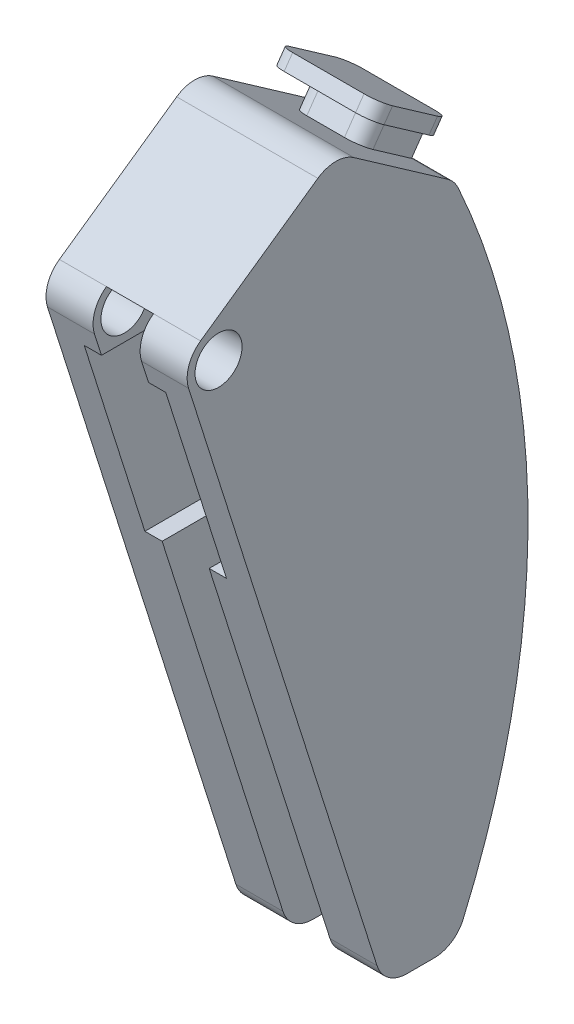
from build123d import *

# Parameters (mm, degrees)
BOSS_EXTRUDE1_DEPTH = 5.715
SKETCH4_W           = 3.81
SKETCH4_H           = 55.271796861
CUT_EXTRUDE3_DEPTH  = 72.793515752
SKETCH6_R           = 1.905
CUT_EXTRUDE5_DEPTH  = 73.472702303
SKETCH5_W           = 6.604
SKETCH5_H           = 15.494
CUT_EXTRUDE4_DEPTH  = 52.07
BOSS_EXTRUDE2_DEPTH = 1.905
BOSS_EXTRUDE3_DEPTH = 1.2


with BuildPart() as part:
    # Sketch1 → Boss-Extrude1 (new, symmetric)
    with BuildSketch(Plane(origin=(0, 0, 0), x_dir=(0, 0, -1), z_dir=(1, 0, 0))):
        with BuildLine():
            Line((56.986930037, 27.2309067), (49.395231729, 32.546671083))
            ThreePointArc((49.395231729, 32.546671083), (47.938347581, 33.00602489), (46.481463433, 32.546671083))
            Line((46.481463433, 32.546671083), (36.982659893, 25.89553724))
            ThreePointArc((36.982659893, 25.89553724), (36.033680051, 24.629396088), (36.018345244, 23.047169493))
            Line((36.018345244, 23.047169493), (51.273584689, -25.063981175))
            ThreePointArc((51.273584689, -25.063981175), (52.194518967, -26.3458465), (53.694783485, -26.836259621))
            Line((53.694783485, -26.836259621), (55.908973953, -26.836259621))
            ThreePointArc((55.908973953, -26.836259621), (57.301856909, -26.420283413), (58.238514534, -25.308603771))
            ThreePointArc((58.238514534, -25.308603771), (63.498135482, 0.4866111), (57.843797801, 26.198188029))
            ThreePointArc((57.843797801, 26.198188029), (57.484796778, 26.772157225), (56.986930037, 27.2309067))
        make_face()
    extrude(amount=BOSS_EXTRUDE1_DEPTH, both=True)

    # Sketch4 → Cut-Extrude3 (cut, through all)
    with BuildSketch(Plane.XY):
        with Locations((0, -1.74036119)):
            Rectangle(SKETCH4_W, SKETCH4_H)
    extrude(amount=-CUT_EXTRUDE3_DEPTH, mode=Mode.SUBTRACT)

    # Sketch6 → Cut-Extrude5 (cut, through all)
    with BuildSketch(Plane(origin=(5.715, 0, 0), x_dir=(0, 0, -1), z_dir=(1, 0, 0))):
        with Locations((38.439544041, 23.814891048)):
            Circle(SKETCH6_R)
    extrude(amount=-CUT_EXTRUDE5_DEPTH, mode=Mode.SUBTRACT)

    # Sketch5 → Cut-Extrude4 (cut)
    with BuildSketch(Plane.XY):
        with Locations((0, 13.527891048)):
            Rectangle(SKETCH5_W, SKETCH5_H)
    extrude(amount=-CUT_EXTRUDE4_DEPTH, mode=Mode.SUBTRACT)

    # Sketch7 → Boss-Extrude2 (add)
    with BuildSketch(Plane(origin=(0, 45.047311475, -31.542467071), x_dir=(1, 0, 0), z_dir=(0, 0.8191520442889956, -0.5735764363510407))):
        with BuildLine():
            Line((1.524, 25.981953814), (-1.524, 25.981953814))
            ThreePointArc((-1.524, 25.981953814), (-2.422025612, 26.353928202), (-2.794, 27.251953814))
            Line((-2.794, 27.251953814), (-2.794, 31.061953814))
            Line((-2.794, 31.061953814), (2.794, 31.061953814))
            Line((2.794, 31.061953814), (2.794, 27.251953814))
            ThreePointArc((2.794, 27.251953814), (2.422025612, 26.353928202), (1.524, 25.981953814))
        make_face()
    extrude(amount=BOSS_EXTRUDE2_DEPTH)

    # Sketch9 → Boss-Extrude3 (add)
    with BuildSketch(Plane(origin=(0, 46.607796119, -32.635130182), x_dir=(1, 0, 0), z_dir=(0, 0.8191520442889956, -0.5735764363510407))):
        with BuildLine():
            Line((2.890823379, 31.061953814), (-2.890823379, 31.061953814))
            ThreePointArc((-2.890823379, 31.061953814), (-3.788848991, 30.689979426), (-4.160823379, 29.791953814))
            Line((-4.160823379, 29.791953814), (-4.160823379, 25.346953814))
            ThreePointArc((-4.160823379, 25.346953814), (-3.788848991, 24.448928202), (-2.890823379, 24.076953814))
            Line((-2.890823379, 24.076953814), (2.890823379, 24.076953814))
            ThreePointArc((2.890823379, 24.076953814), (3.788848991, 24.448928202), (4.160823379, 25.346953814))
            Line((4.160823379, 25.346953814), (4.160823379, 29.791953814))
            ThreePointArc((4.160823379, 29.791953814), (3.788848991, 30.689979426), (2.890823379, 31.061953814))
        make_face()
    extrude(amount=BOSS_EXTRUDE3_DEPTH)


solid = part.part
